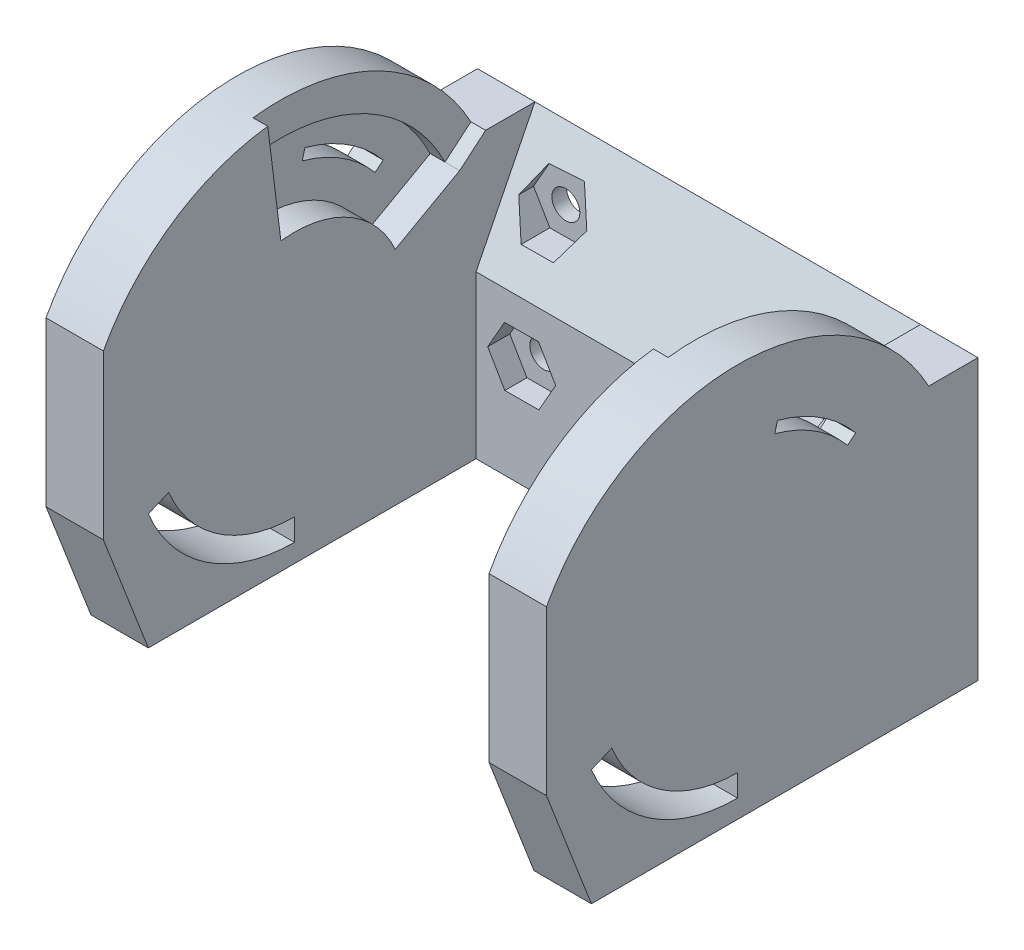
from build123d import *

# Parameters (mm, degrees)
CROQUIS1_W              = 34
CROQUIS1_H              = 19
SALIENTE_EXTRUIR1_DEPTH = 35
CROQUIS2_W              = 26.2
CROQUIS2_H              = 31
CORTAR_EXTRUIR1_DEPTH   = 25
CORTAR_EXTRUIR3_DEPTH   = 26.2
SALIENTE_EXTRUIR2_DEPTH = 34
CROQUIS10_W             = 26.2
CROQUIS10_H             = 25.966324345
CORTAR_EXTRUIR4_DEPTH   = 10
CORTAR_EXTRUIR5_START   = -34
CORTAR_EXTRUIR5_DEPTH   = 34
CORTAR_EXTRUIR6_DEPTH   = 2
CORTAR_EXTRUIR7_START   = 28.2
CORTAR_EXTRUIR7_DEPTH   = 28.2
CORTAR_EXTRUIR8_DEPTH   = 1
CORTAR_EXTRUIR9_DEPTH   = 27.2
CORTAR_EXTRUIR10_START  = -34
CORTAR_EXTRUIR10_DEPTH  = 34
CROQUIS18_R             = 0.95
CORTAR_EXTRUIR11_DEPTH  = 4
CORTAR_EXTRUIR12_DEPTH  = 1.5
CORTAR_EXTRUIR13_DEPTH  = 3


with BuildPart() as part:
    # Croquis1 → Saliente-Extruir1 (new body)
    with BuildSketch(Plane.XY):
        with Locations((-31.887263086, 5.12254902)):
            Rectangle(CROQUIS1_W, CROQUIS1_H)
    extrude(amount=SALIENTE_EXTRUIR1_DEPTH)

    # Croquis2 → Cortar-Extruir1 (cut)
    with BuildSketch(Plane.XZ.offset(4.37745098)):
        with Locations((-31.887263086, 19.5)):
            Rectangle(CROQUIS2_W, CROQUIS2_H)
    extrude(amount=-CORTAR_EXTRUIR1_DEPTH, mode=Mode.SUBTRACT)

    # Croquis4 → Cortar-Extruir3 (cut)
    with BuildSketch(Plane.ZY.offset(18.787263086)):
        Polygon((4, 14.62254902), (4, 6.62254902), (0, 14.62254902), align=None)
    extrude(amount=CORTAR_EXTRUIR3_DEPTH, mode=Mode.SUBTRACT)

    # Croquis9 → Saliente-Extruir2 (add)
    with BuildSketch(Plane(origin=(-14.887263086, 0, 0), x_dir=(0, 0, -1), z_dir=(1, 0, 0))):
        with BuildLine():
            Line((-29.315831827, 14.62254902), (-3.349507482, 14.62254902))
            ThreePointArc((-3.349507482, 14.62254902), (-16.332669655, 22.37254902), (-29.315831827, 14.62254902))
        make_face()
    extrude(amount=-SALIENTE_EXTRUIR2_DEPTH)

    # Croquis10 → Cortar-Extruir4 (cut)
    with BuildSketch(Plane.XZ.offset(-14.62254902)):
        with Locations((-31.887263086, 16.332669655)):
            Rectangle(CROQUIS10_W, CROQUIS10_H)
    extrude(amount=-CORTAR_EXTRUIR4_DEPTH, mode=Mode.SUBTRACT)

    # Croquis11 → Cortar-Extruir5 (cut)
    with BuildSketch(Plane(origin=(-14.887263086, 0, 0), x_dir=(0, 0, -1), z_dir=(1, 0, 0)).offset(CORTAR_EXTRUIR5_START)):
        with BuildLine():
            Line((-26.264575199, 3.509186373), (-24.878727914, 4.083143951))
            ThreePointArc((-24.878727914, 4.083143951), (-21.471881808, -0.068419609), (-16.332669655, -1.62745098))
            Line((-16.332669655, -1.62745098), (-16.332669655, -3.12745098))
            ThreePointArc((-16.332669655, -3.12745098), (-22.305267563, -1.31560371), (-26.264575199, 3.509186373))
        make_face()
        with BuildLine():
            Line((-13.621540157, 17.74062205), (-13.807242822, 17.04757027))
            ThreePointArc((-13.807242822, 17.04757027), (-11.089968726, 15.851941052), (-8.857991001, 13.894549121))
            Line((-8.857991001, 13.894549121), (-8.308354113, 14.355749231))
            ThreePointArc((-8.308354113, 14.355749231), (-10.704456257, 16.457074414), (-13.621540157, 17.74062205))
        make_face()
    extrude(amount=CORTAR_EXTRUIR5_DEPTH, mode=Mode.SUBTRACT)

    # Croquis12 → Cortar-Extruir6 (cut)
    with BuildSketch(Plane.ZY.offset(18.787263086)):
        with BuildLine():
            Line((17.258889566, 15.065137056), (17.873210354, 20.027255157))
            ThreePointArc((17.873210354, 20.027255157), (10.39091869, 18.620075808), (5.112868034, 13.133089064))
            Line((5.112868034, 13.133089064), (9.488064371, 10.688715764))
            ThreePointArc((9.488064371, 10.688715764), (12.652304566, 14.157448622), (17.258889566, 15.065137056))
        make_face()
    extrude(amount=-CORTAR_EXTRUIR6_DEPTH, mode=Mode.SUBTRACT)

    # Croquis14 → Cortar-Extruir7 (cut)
    with BuildSketch(Plane.ZY.offset(18.787263086).offset(CORTAR_EXTRUIR7_START)):
        with BuildLine():
            Line((17.873210354, 20.027255157), (17.258889566, 15.065137056))
            ThreePointArc((17.258889566, 15.065137056), (12.652304566, 14.157448622), (9.488064371, 10.688715764))
            Line((9.488064371, 10.688715764), (5.112868034, 13.133089064))
            ThreePointArc((5.112868034, 13.133089064), (10.39091869, 18.620075808), (17.873210354, 20.027255157))
        make_face()
    extrude(amount=-CORTAR_EXTRUIR7_DEPTH, mode=Mode.SUBTRACT)

    # Croquis15 → Cortar-Extruir8 (cut)
    with BuildSketch(Plane.ZY.offset(18.787263086)):
        with BuildLine():
            Line((17.873210354, 20.027255157), (18.15050768, 22.260102262))
            ThreePointArc((18.15050768, 22.260102262), (9.568856329, 20.730307382), (3.349507482, 14.62254902))
            Line((3.349507482, 14.62254902), (5.112868034, 13.133089064))
            ThreePointArc((5.112868034, 13.133089064), (10.39091869, 18.620075808), (17.873210354, 20.027255157))
        make_face()
    extrude(amount=-CORTAR_EXTRUIR8_DEPTH, mode=Mode.SUBTRACT)

    # Croquis15<2> → Cortar-Extruir9 (cut)
    with BuildSketch(Plane.ZY.offset(18.787263086)):
        with BuildLine():
            Line((17.873210354, 20.027255157), (18.15050768, 22.260102262))
            ThreePointArc((18.15050768, 22.260102262), (9.568856329, 20.730307382), (3.349507482, 14.62254902))
            Line((3.349507482, 14.62254902), (5.112868034, 13.133089064))
            ThreePointArc((5.112868034, 13.133089064), (10.39091869, 18.620075808), (17.873210354, 20.027255157))
        make_face()
    extrude(amount=CORTAR_EXTRUIR9_DEPTH, mode=Mode.SUBTRACT)

    # Croquis17 → Cortar-Extruir10 (cut)
    with BuildSketch(Plane(origin=(-14.887263086, 0, 0), x_dir=(0, 0, -1), z_dir=(1, 0, 0)).offset(CORTAR_EXTRUIR10_START)):
        Polygon((-29.315831827, 3.509186373), (-29.315831827, 14.62254902), (-35, 14.62254902), (-35, -4.37745098), (-26.264575199, -4.37745098), align=None)
    extrude(amount=CORTAR_EXTRUIR10_DEPTH, mode=Mode.SUBTRACT)

    # Croquis18 → Cortar-Extruir11 (cut)
    with BuildSketch(Plane(origin=(0, 0, 0), x_dir=(-1, 0, 0), z_dir=(0, 0, -1))):
        with Locations((41.887263086, 2.62254902)):
            Circle(CROQUIS18_R)
        with Locations((21.887263086, 2.62254902)):
            Circle(CROQUIS18_R)
        with Locations((21.887263086, 10.62254902)):
            Circle(CROQUIS18_R)
        with Locations((41.887263086, 10.62254902)):
            Circle(CROQUIS18_R)
    extrude(amount=-CORTAR_EXTRUIR11_DEPTH, mode=Mode.SUBTRACT)

    # Croquis19 → Cortar-Extruir12 (cut)
    with BuildSketch(Plane.XY.offset(4)):
        Polygon((-43.030772734, 0.616129568), (-40.721407694, 0.629030888), (-39.577898045, 2.63545034), (-40.743753437, 4.628968471), (-43.053118477, 4.616067151), (-44.196628126, 2.609647699), align=None)
        Polygon((-23.030772734, 0.616129568), (-20.721407694, 0.629030888), (-19.577898045, 2.63545034), (-20.743753437, 4.628968471), (-23.053118477, 4.616067151), (-24.196628126, 2.609647699), align=None)
    extrude(amount=-CORTAR_EXTRUIR12_DEPTH, mode=Mode.SUBTRACT)

    # Croquis20 → Cortar-Extruir13 (cut)
    with BuildSketch(Plane.XY.offset(4)):
        Polygon((-44.081159874, 10.610292765), (-42.973597252, 8.71645054), (-40.779700463, 8.728706795), (-39.520722563, 10.735771313), (-40.628285185, 12.629613538), (-42.994825708, 12.516391244), align=None)
        Polygon((-24.081159874, 10.610292765), (-22.973597252, 8.71645054), (-20.779700463, 8.728706795), (-19.520722563, 10.735771313), (-20.628285185, 12.629613538), (-22.994825708, 12.516391244), align=None)
    extrude(amount=-CORTAR_EXTRUIR13_DEPTH, mode=Mode.SUBTRACT)


solid = part.part
